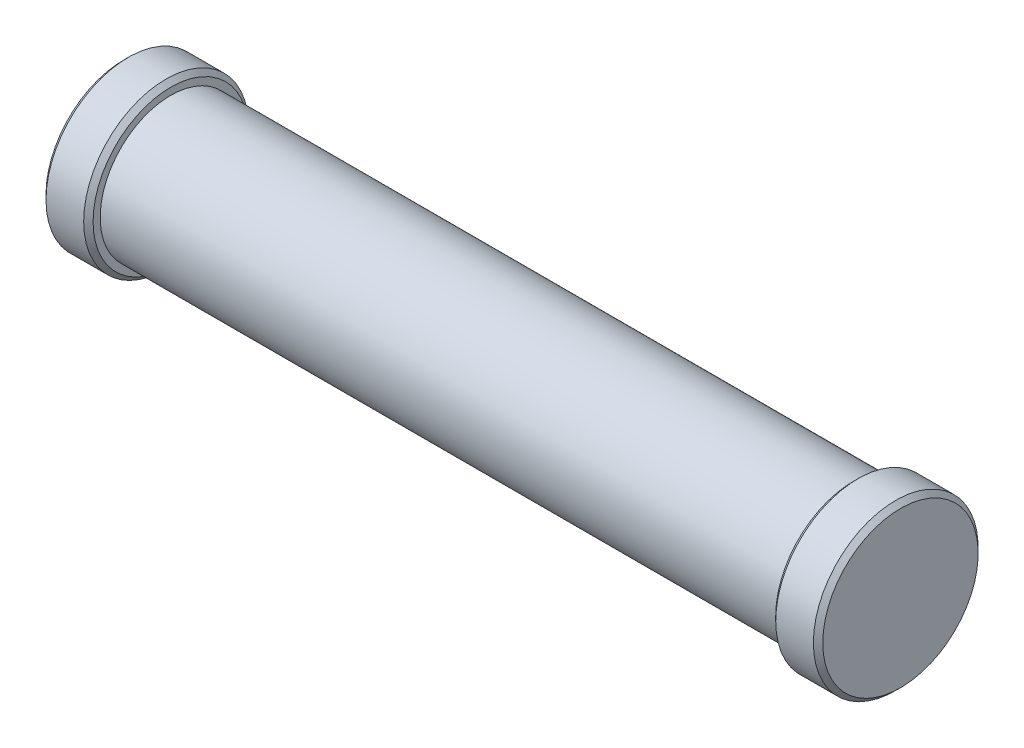
from build123d import *

# Parameters (mm, degrees)
SKETCH1_R           = 30
BOSS_EXTRUDE1_DEPTH = 145
SKETCH2_R           = 35
BOSS_EXTRUDE2_DEPTH = 20
CHAMFER1_SIZE       = 2


with BuildPart() as part:
    # Sketch1 → Boss-Extrude1 (new, symmetric)
    with BuildSketch(Plane(origin=(0, 0, 0), x_dir=(0, 0, -1), z_dir=(1, 0, 0))):
        Circle(SKETCH1_R)
    extrude(amount=BOSS_EXTRUDE1_DEPTH, both=True)


with BuildPart() as body_2:
    # Sketch2 → Boss-Extrude2 (new body)
    with BuildSketch(Plane.ZY.offset(145)):
        Circle(SKETCH2_R)
    extrude(amount=BOSS_EXTRUDE2_DEPTH)

    # Chamfer1
    chamfer1_edges = [body_2.edges().sort_by_distance(p)[0] for p in [
        (-145, 0, -35),
        (-165, 0, -35),
    ]]
    chamfer(chamfer1_edges, length=CHAMFER1_SIZE)


with BuildPart() as body_3:
    # Mirror1: mirrored copy
    add(body_2.part.mirror(Plane(origin=(0, 0, 0), x_dir=(0, 0, 1), z_dir=(1, 0, 0))))


solid = Compound([part.part, body_2.part, body_3.part])
